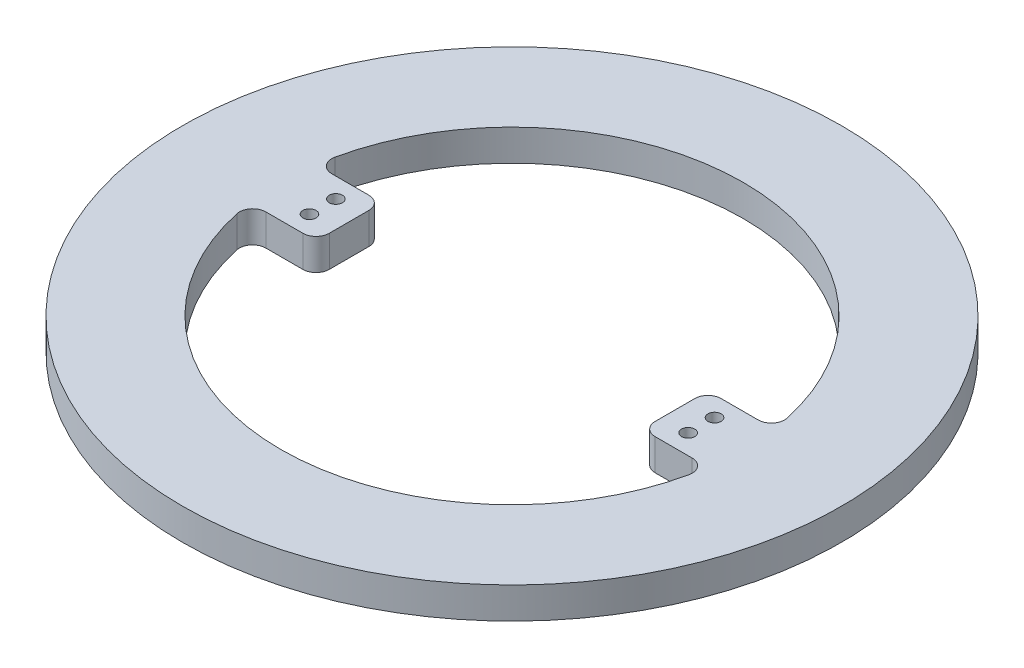
from build123d import *

# Parameters (mm, degrees)
SKETCH1_R           = 49.95
SKETCH1_R_2         = 1
BOSS_EXTRUDE1_DEPTH = 4.75


with BuildPart() as part:
    # Sketch1 → Boss-Extrude1 (new body)
    with BuildSketch(Plane(origin=(0, 0, 0), x_dir=(1, 0, 0), z_dir=(0, 1, 0))):
        Circle(SKETCH1_R)
        with Locations((-28.698085879, -2)):
            Circle(SKETCH1_R_2, mode=Mode.SUBTRACT)
        with Locations((-28.698085879, 2)):
            Circle(SKETCH1_R_2, mode=Mode.SUBTRACT)
        with Locations((28.698085879, -2)):
            Circle(SKETCH1_R_2, mode=Mode.SUBTRACT)
        with Locations((28.698085879, 2)):
            Circle(SKETCH1_R_2, mode=Mode.SUBTRACT)
        with BuildLine():
            Line((-32.306829346, -5), (-26.698085879, -5))
            ThreePointArc((-26.698085879, -5), (-25.283872317, -4.414213562), (-24.698085879, -3))
            Line((-24.698085879, -3), (-24.698085879, 3))
            ThreePointArc((-24.698085879, 3), (-25.283872317, 4.414213562), (-26.698085879, 5))
            Line((-26.698085879, 5), (-32.306829346, 5))
            ThreePointArc((-32.306829346, 5), (-33.863594421, 5.744419457), (-34.261473284, 7.423517499))
            ThreePointArc((-34.261473284, 7.423517499), (0, 35.05648533), (34.261473284, 7.423517499))
            ThreePointArc((34.261473284, 7.423517499), (33.863594421, 5.744419457), (32.306829346, 5))
            Line((32.306829346, 5), (26.698085879, 5))
            ThreePointArc((26.698085879, 5), (25.283872317, 4.414213562), (24.698085879, 3))
            Line((24.698085879, 3), (24.698085879, -3))
            ThreePointArc((24.698085879, -3), (25.283872317, -4.414213562), (26.698085879, -5))
            Line((26.698085879, -5), (32.306829346, -5))
            ThreePointArc((32.306829346, -5), (33.863594421, -5.744419457), (34.261473284, -7.423517499))
            ThreePointArc((34.261473284, -7.423517499), (0, -35.05648533), (-34.261473284, -7.423517499))
            ThreePointArc((-34.261473284, -7.423517499), (-33.863594421, -5.744419457), (-32.306829346, -5))
        make_face(mode=Mode.SUBTRACT)
    extrude(amount=BOSS_EXTRUDE1_DEPTH)


solid = part.part
